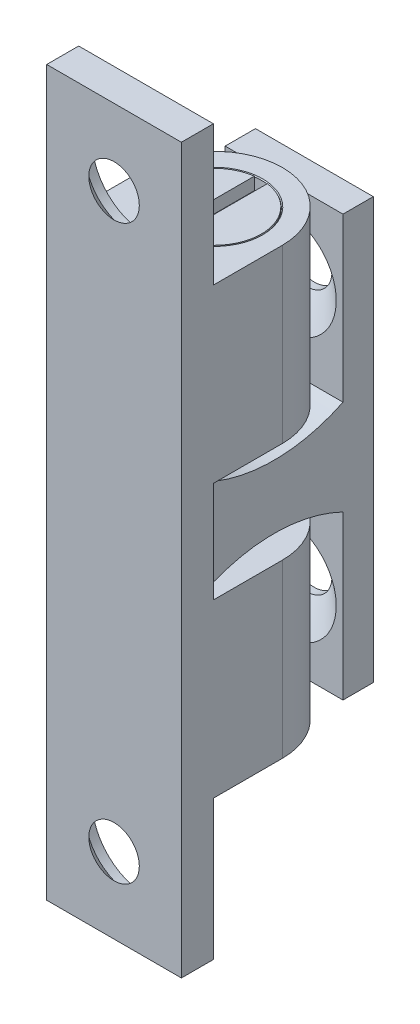
from build123d import *

# Parameters (mm, degrees)
BOSS_EXTRUDE1_DEPTH      = 4.0005
BOSS_EXTRUDE1_DEPTH_BACK = 4.0005
BOSS_EXTRUDE2_DEPTH      = 3.50012
BOSS_EXTRUDE2_DEPTH_BACK = 3.50012
CUT_EXTRUDE1_DEPTH       = 36.432819564
SKETCH13_R               = 2.82575
CUT_EXTRUDE2_DEPTH       = 1.275
SKETCH15_R               = 2.80035
BOSS_EXTRUDE3_DEPTH      = 1.275
CUT_EXTRUDE4_DEPTH       = 0.749709702
FILLET1_R                = 0.5000244
SKETCH12_W               = 1.8
SKETCH12_H               = 1.49987
CHAMFER1_SIZE            = 0.056007


with BuildPart() as part:
    # Sketch3 → Boss-Extrude1 (new, two sides: drawn at the far end of the back side and taken through both)
    with BuildSketch(Plane(origin=(0, 0, 0), x_dir=(0, 0, -1), z_dir=(1, 0, 0)).offset(-BOSS_EXTRUDE1_DEPTH_BACK)):
        Polygon((-4.05, 13.2), (-4.05, 21.49983), (-5.95, 21.49983), (-5.95, -21.49983), (-4.05, -21.49983), (-4.05, -13.2), (4.05006, -13.2), (4.05006, -3), (-4.05, -3), (-4.05, 3), (4.05006, 3), (4.05006, 13.2), align=None)
    extrude(amount=BOSS_EXTRUDE1_DEPTH + BOSS_EXTRUDE1_DEPTH_BACK)

    # Sketch5 → Cut-Extrude1 (cut, through all)
    with BuildSketch(Plane(origin=(0, 13.2, 0), x_dir=(1, 0, 0), z_dir=(0, 1, 0))):
        with BuildLine():
            Line((-4.0005, 4.05006), (-4.0005, 0.04956))
            ThreePointArc((-4.0005, 0.04956), (-2.828780678, 2.878340678), (0, 4.05006))
            Line((0, 4.05006), (-4.0005, 4.05006))
        make_face()
        with BuildLine():
            Line((4.0005, 4.05006), (0, 4.05006))
            ThreePointArc((0, 4.05006), (2.828780678, 2.878340678), (4.0005, 0.04956))
            Line((4.0005, 0.04956), (4.0005, 4.05006))
        make_face()
    extrude(amount=-CUT_EXTRUDE1_DEPTH, mode=Mode.SUBTRACT)

    # Sketch6 → Cut-Revolve1 (revolve, cut)
    with BuildSketch(Plane(origin=(0, 3.5, 0), x_dir=(1, 0, 0), z_dir=(0, 1, 0))):
        with BuildLine():
            Line((-2.025015, 3e-05), (2.025015, 3e-05))
            ThreePointArc((2.025015, 3e-05), (0, 2.025045), (-2.025015, 3e-05))
        make_face()
    cut_revolve1 = revolve(axis=Axis((-2.025015, 3.5, -3e-05), (1, 0, 0)), mode=Mode.SUBTRACT)

    # Sketch13 → Cut-Extrude2 (cut)
    with BuildSketch(Plane(origin=(0, 13.2, 0), x_dir=(1, 0, 0), z_dir=(0, 1, 0))):
        with Locations(Location((0, 0, 0), (0, 0, 270))):
            Circle(SKETCH13_R)
    cut_extrude2 = extrude(amount=-CUT_EXTRUDE2_DEPTH, mode=Mode.SUBTRACT)

    # Sketch9 → Cut-Revolve2 (revolve, cut)
    with BuildSketch(Plane(origin=(0, 0, 0), x_dir=(0, 0, -1), z_dir=(1, 0, 0)), mode=Mode.PRIVATE) as cut_revolve2_sk:
        Polygon((-5.95, 18.49987), (-5.95, 17), (-4.05, 17), (-4.05, 20.2), (-4.926189367, 20.2), (-4.926189367, 19.72), align=None)
    cut_revolve2 = revolve(cut_revolve2_sk.sketch.rotate(Axis((0, 17, 5.95), (0, 0, -1)), 90), axis=Axis((0, 17, 5.95), (0, 0, -1)), mode=Mode.SUBTRACT)

    # Mirror1: Cut-Revolve1, Cut-Extrude2, Cut-Revolve2 across plane
    add(cut_revolve1.mirror(Plane.ZX), mode=Mode.SUBTRACT)
    add(cut_extrude2.mirror(Plane.ZX), mode=Mode.SUBTRACT)
    add(cut_revolve2.mirror(Plane.ZX), mode=Mode.SUBTRACT)

    # Chamfer1
    chamfer1_edges = [part.edges().sort_by_distance(p)[0] for p in [
        (0, 13.2, -2.82575),
        (0, -13.2, -2.82575),
    ]]
    chamfer(chamfer1_edges, length=CHAMFER1_SIZE)


with BuildPart() as body_2:
    # Sketch4 → Boss-Extrude2 (new, two sides: drawn at the far end of the back side and taken through both)
    with BuildSketch(Plane(origin=(0, 0, 0), x_dir=(0, 0, -1), z_dir=(1, 0, 0)).offset(-BOSS_EXTRUDE2_DEPTH_BACK)):
        with BuildLine():
            Line((4.15, 2.825), (4.15, 12.50061))
            Line((4.15, 12.50061), (5.95, 12.50061))
            Line((5.95, 12.50061), (5.95, -12.50061))
            Line((5.95, -12.50061), (4.15, -12.50061))
            Line((4.15, -12.50061), (4.15, -2.825))
            ThreePointArc((4.15, -2.825), (0.05, -1.883333333), (-4.05, -2.825))
            Line((-4.05, -2.825), (-4.05, 2.825))
            ThreePointArc((-4.05, 2.825), (0.05, 1.883333333), (4.15, 2.825))
        make_face()
    extrude(amount=BOSS_EXTRUDE2_DEPTH + BOSS_EXTRUDE2_DEPTH_BACK)

    # Fillet1
    fillet1_edges = [body_2.edges().sort_by_distance(p)[0] for p in [
        (0, -2.825, 4.05),
        (0, 2.825, 4.05),
    ]]
    fillet(fillet1_edges, radius=FILLET1_R)

    # Sketch12 → Cut-Revolve4 (revolve, cut)
    with BuildSketch(Plane(origin=(0, 0, 0), x_dir=(0, 0, -1), z_dir=(1, 0, 0))):
        with Locations((5.05, 8.599805)):
            Rectangle(SKETCH12_W, SKETCH12_H)
    cut_revolve4 = revolve(axis=Axis((0, 7.84987, -5.95), (0, 0, 1)), mode=Mode.SUBTRACT)

    # Sketch10 → Cut-Revolve3 (revolve, cut)
    with BuildSketch(Plane(origin=(0, 0, 0), x_dir=(0, 0, -1), z_dir=(1, 0, 0))):
        Polygon((4.15, 7.84987), (4.15, 10.94987), (5.95, 8.804713533), (5.95, 7.84987), align=None)
    cut_revolve3 = revolve(axis=Axis((0, 7.84987, -5.95), (0, 0, 1)), mode=Mode.SUBTRACT)

    # Mirror4: Cut-Revolve4, Cut-Revolve3 across plane
    add(cut_revolve4.mirror(Plane.ZX), mode=Mode.SUBTRACT)
    add(cut_revolve3.mirror(Plane.ZX), mode=Mode.SUBTRACT)


with BuildPart() as body_3:
    # Sketch7 → Revolve1 (revolve)
    with BuildSketch(Plane(origin=(0, 3.5, 0), x_dir=(1, 0, 0), z_dir=(0, 1, 0))):
        with BuildLine():
            Line((-2.025015, 3e-05), (2.025015, 3e-05))
            ThreePointArc((2.025015, 3e-05), (0, 2.025045), (-2.025015, 3e-05))
        make_face()
    revolve(axis=Axis((-2.025015, 3.5, -3e-05), (1, 0, 0)))


with BuildPart() as body_4:
    # Sketch15 → Boss-Extrude3 (new body)
    with BuildSketch(Plane(origin=(0, 11.925, 0), x_dir=(1, 0, 0), z_dir=(0, 1, 0))):
        with Locations(Location((0, 0, 0), (0, 0, 270))):
            Circle(SKETCH15_R)
    extrude(amount=BOSS_EXTRUDE3_DEPTH)

    # Sketch14 → Cut-Extrude4 (cut)
    with BuildSketch(Plane(origin=(0, 13.2, 0), x_dir=(1, 0, 0), z_dir=(0, 1, 0))):
        with BuildLine():
            Line((-0.3864483, 2.773556892), (-0.3864483, -2.773556892))
            ThreePointArc((-0.3864483, -2.773556892), (0, -2.80035), (0.3864483, -2.773556892))
            Line((0.3864483, -2.773556892), (0.3864483, 2.773556892))
            ThreePointArc((0.3864483, 2.773556892), (0, 2.80035), (-0.3864483, 2.773556892))
        make_face()
    extrude(amount=-CUT_EXTRUDE4_DEPTH, mode=Mode.SUBTRACT)


with BuildPart() as body_5:
    # Mirror3: mirrored copy
    add(body_3.part.mirror(Plane.ZX))


with BuildPart() as body_6:
    # Mirror3 2: mirrored copy
    add(body_4.part.mirror(Plane.ZX))


with BuildPart() as body_7:
    # Body-Move/Copy1: copy of body 2
    add(body_2.part.moved(Location((0, 0, -19.999999878))))


solid = Compound([part.part, body_2.part, body_3.part, body_4.part, body_5.part, body_6.part])
